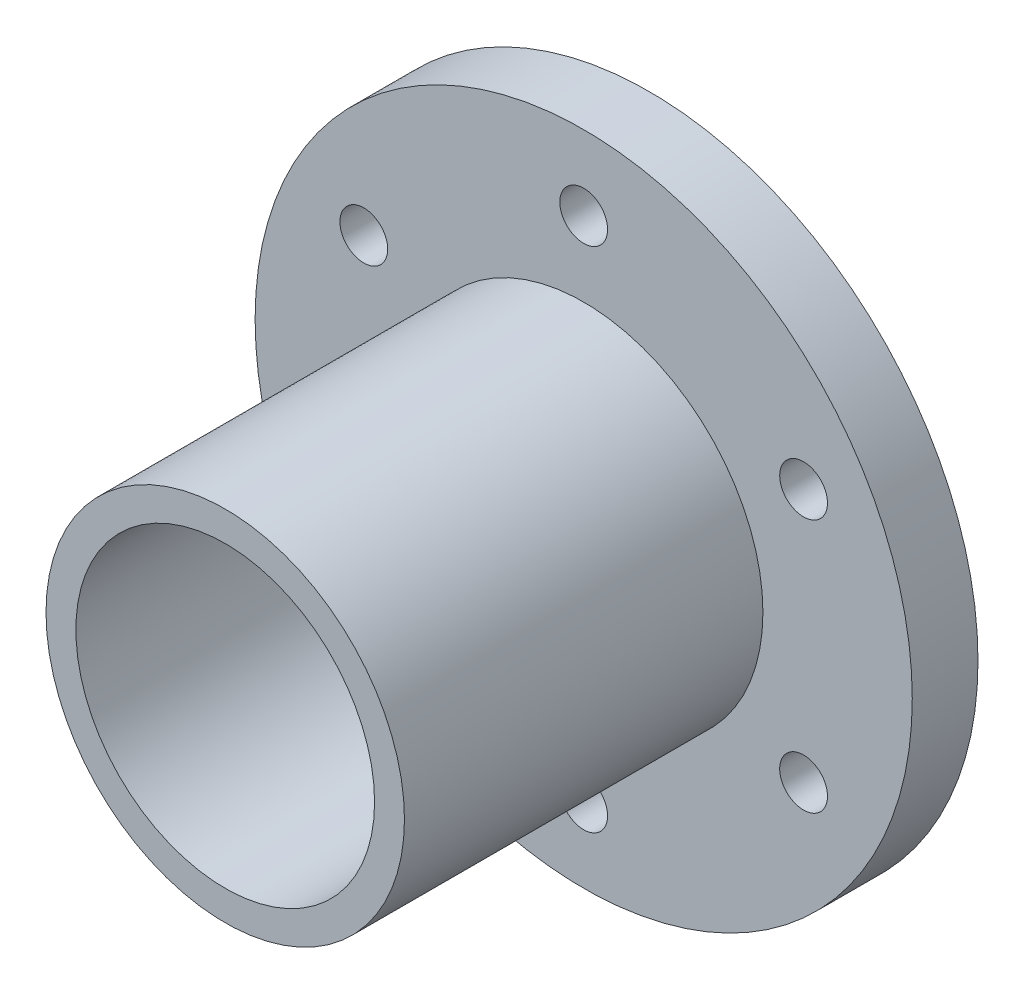
from build123d import *

# Parameters (mm, degrees)
SKETCH1_R               = 110
BOSS_EXTRUDE2_DEPTH     = 22
SKETCH2_R               = 60
BOSS_EXTRUDE3_DEPTH     = 120
CUT_EXTRUDE1_DEPTH      = 211.627633515
CUT_EXTRUDE1_DEPTH_BACK = 211.627633515
SKETCH3_R               = 50
SKETCH4_R               = 8
CUT_EXTRUDE2_DEPTH      = 197.468827044
CIRPATTERN1_COUNT       = 6


with BuildPart() as part:
    # Sketch1 → Boss-Extrude2 (new body)
    with BuildSketch(Plane.XY):
        Circle(SKETCH1_R)
    extrude(amount=BOSS_EXTRUDE2_DEPTH)

    # Sketch2 → Boss-Extrude3 (add)
    with BuildSketch(Plane.XY.offset(22)):
        Circle(SKETCH2_R)
    extrude(amount=BOSS_EXTRUDE3_DEPTH)

    # Sketch3 → Cut-Extrude1 (cut, two sides: drawn at the far end of the back side and taken through both)
    with BuildSketch(Plane.XY.offset(142).offset(-CUT_EXTRUDE1_DEPTH_BACK)):
        Circle(SKETCH3_R)
    extrude(amount=CUT_EXTRUDE1_DEPTH + CUT_EXTRUDE1_DEPTH_BACK, mode=Mode.SUBTRACT)

    # Sketch4 → Cut-Extrude2 (cut, symmetric)
    with BuildSketch(Plane.XY.offset(22)):
        with Locations((0, 85)):
            Circle(SKETCH4_R)
    cut_extrude2 = extrude(amount=CUT_EXTRUDE2_DEPTH, both=True, mode=Mode.SUBTRACT)

    # CirPattern1: Cut-Extrude2 ×6 about axis
    cirpattern1_axis = Axis((0, 0, 0), (0, 0, 1))
    for i in range(1, CIRPATTERN1_COUNT):
        add(cut_extrude2.rotate(cirpattern1_axis, i * 360 / CIRPATTERN1_COUNT), mode=Mode.SUBTRACT)


solid = part.part
